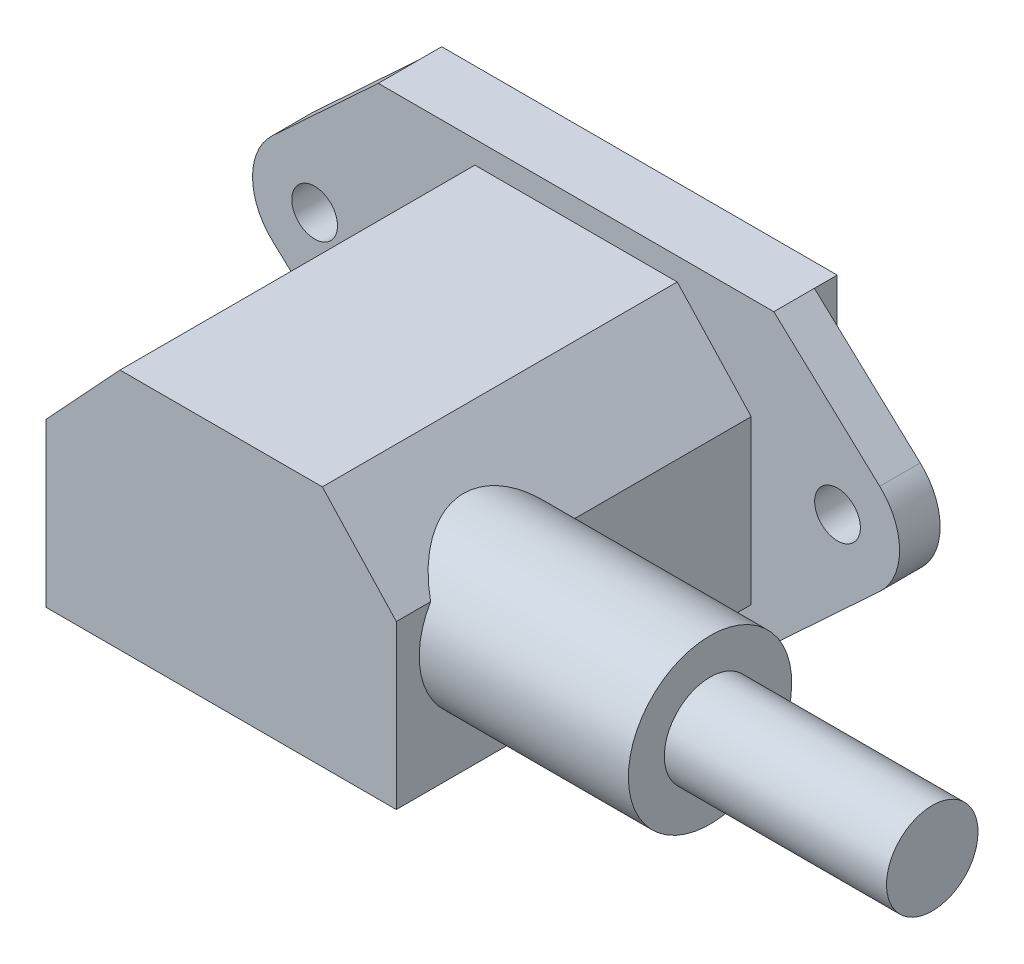
from build123d import *

# Parameters (mm, degrees)
SKETCH_1_W                  = 30.26
SKETCH_1_H                  = 22
EXTRUDE_1_DEPTH             = 1.75
SKETCH_2_R                  = 1.75
EXTRUDE_2_DEPTH             = 3.1
EXTRUDE_3_DEPTH             = 27.15
SKETCH_4_R                  = 6.25
EXTRUDE_4_DEPTH             = 16
EXTRUDE_4_DIRECTION_2_REACH = 55.349
SKETCH_5_R                  = 3.5
EXTRUDE_5_DEPTH             = 17
CUT_EXTRUDE_1_DEPTH         = 17


with BuildPart() as part:
    # 草图1 → 凸台-拉伸1 (new body)
    with BuildSketch(Plane.XY):
        with Locations((0, 8.15)):
            Rectangle(SKETCH_1_W, SKETCH_1_H)
        Polygon((7.25, 16.3), (-7.25, 16.3), (-12.175, 11), (-12.175, 0), (12.175, 0), (12.175, 11), align=None, mode=Mode.SUBTRACT)
    extrude(amount=EXTRUDE_1_DEPTH)

    # 草图2 → 凸台-拉伸2 (add)
    with BuildSketch(Plane.XY.offset(1.75)):
        with BuildLine():
            Line((-15.13, 19.15), (15.13, 19.15))
            Line((15.13, 19.15), (23.231176295, 11.631666232))
            ThreePointArc((23.231176295, 11.631666232), (24.75, 8.15), (23.231176295, 4.668333768))
            Line((23.231176295, 4.668333768), (15.13, -2.85))
            Line((15.13, -2.85), (-15.13, -2.85))
            Line((-15.13, -2.85), (-23.231176295, 4.668333768))
            ThreePointArc((-23.231176295, 4.668333768), (-24.75, 8.15), (-23.231176295, 11.631666232))
            Line((-23.231176295, 11.631666232), (-15.13, 19.15))
        make_face()
        with Locations(Location((-20, 8.15, 0), (0, 0, 180))):
            Circle(SKETCH_2_R, mode=Mode.SUBTRACT)
        with Locations(Location((20, 8.15, 0), (0, 0, 180))):
            Circle(SKETCH_2_R, mode=Mode.SUBTRACT)
    extrude(amount=EXTRUDE_2_DEPTH)

    # 草图3 → 凸台-拉伸3 (add)
    with BuildSketch(Plane.XY.offset(4.85)):
        Polygon((13.4, -1.125), (-13.4, -1.125), (-13.4, 11.33280506), (-7.738856589, 17.425), (7.738856589, 17.425), (13.4, 11.33280506), align=None)
    extrude(amount=EXTRUDE_3_DEPTH)

    # 草图4 → 凸台-拉伸4 (add)
    with BuildSketch(Plane(origin=(13.4, 0, 0), x_dir=(0, 0, -1), z_dir=(1, 0, 0))):
        with Locations(Location((-24, 8.15, 0), (0, 0, 90))):
            Circle(SKETCH_4_R)
    extrude(amount=EXTRUDE_4_DEPTH)

    # 草图4 → 凸台-拉伸4 direction 2 (add, up to next)
    with BuildSketch(Plane(origin=(13.4, 0, 0), x_dir=(0, 0, -1), z_dir=(1, 0, 0)), mode=Mode.PRIVATE) as extrude_4_direction_2_sk1:
        with Locations(Location((-24, 8.15, 0), (0, 0, 90))):
            Circle(SKETCH_4_R)
    extrude_4_direction_2_tool1 = extrude(extrude_4_direction_2_sk1.sketch, amount=-EXTRUDE_4_DIRECTION_2_REACH, mode=Mode.PRIVATE) - part.part
    add(extrude_4_direction_2_tool1.solids().sort_by_distance((13.4, 8.15, 24))[0])

    # 草图5 → 凸台-拉伸5 (add)
    with BuildSketch(Plane(origin=(29.4, 0, 0), x_dir=(0, 0, -1), z_dir=(1, 0, 0))):
        with Locations(Location((-24, 8.15, 0), (0, 0, 90))):
            Circle(SKETCH_5_R)
    extrude(amount=EXTRUDE_5_DEPTH)

    # 草图6 → 切除-拉伸1 (cut)
    with BuildSketch(Plane(origin=(0, 0, 1.75), x_dir=(-1, 0, 0), z_dir=(0, 0, -1))):
        Polygon((-12.175, 11), (-12.175, 0), (12.175, 0), (12.175, 11), (7.25, 16.3), (-7.25, 16.3), align=None)
    extrude(amount=-CUT_EXTRUDE_1_DEPTH, mode=Mode.SUBTRACT)


solid = part.part
